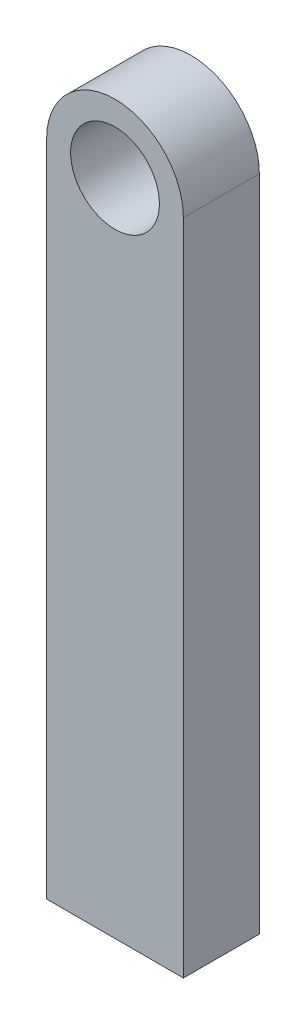
from build123d import *

# Parameters (mm, degrees)
SKETCH1_R           = 17.525
BOSS_EXTRUDE1_DEPTH = 30


with BuildPart() as part:
    # Sketch1 → Boss-Extrude1 (new body)
    with BuildSketch(Plane.XY):
        with BuildLine():
            Line((0, 0), (54, 0))
            Line((54, 0), (54, 260))
            ThreePointArc((54, 260), (27, 287), (0, 260))
            Line((0, 260), (0, 0))
        make_face()
        with Locations((27, 260)):
            Circle(SKETCH1_R, mode=Mode.SUBTRACT)
    extrude(amount=BOSS_EXTRUDE1_DEPTH)


solid = part.part
